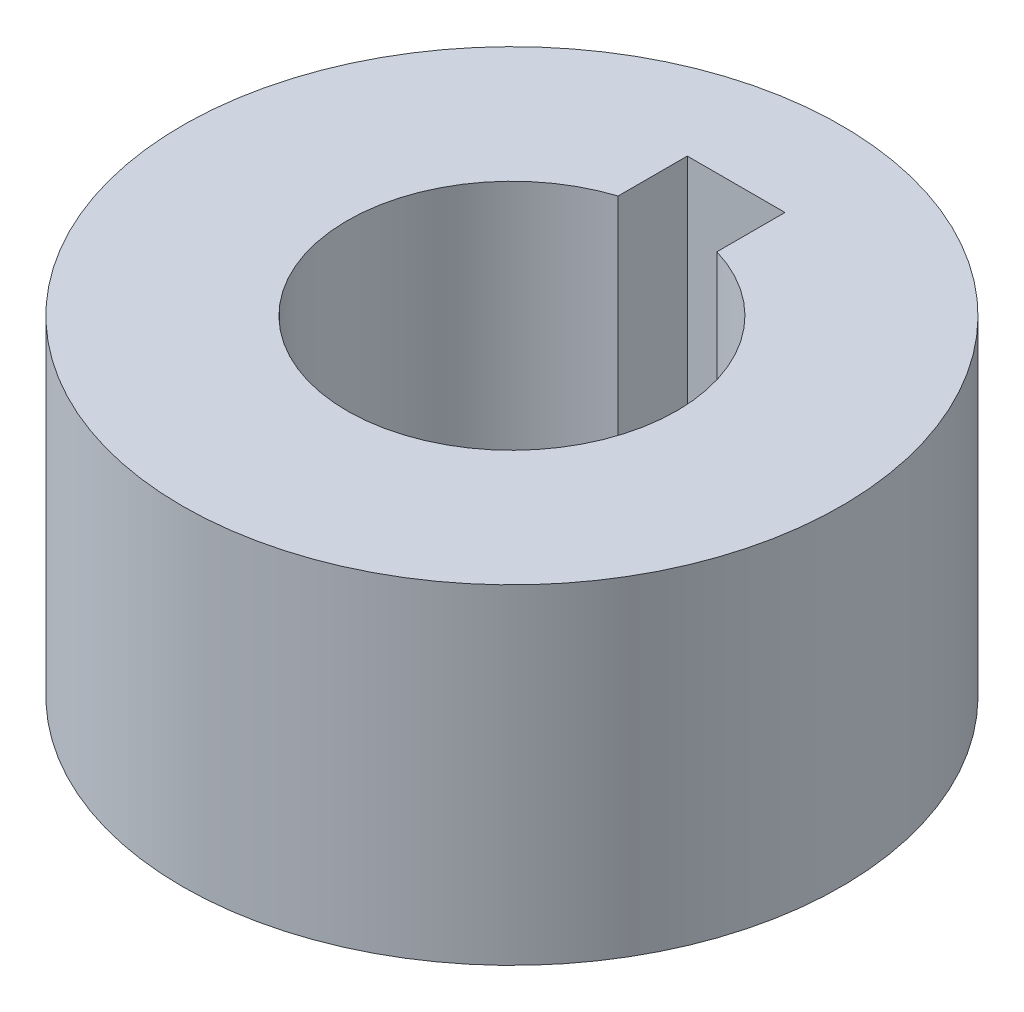
from build123d import *

# Parameters (mm, degrees)
SKETCH_1_R      = 10
EXTRUDE_1_DEPTH = 10


with BuildPart() as part:
    # 스케치1 → 보스-돌출1 (new body)
    with BuildSketch(Plane(origin=(0, 0, 0), x_dir=(1, 0, 0), z_dir=(0, 1, 0))):
        with Locations(Location((0, 0, 0), (0, 0, 270))):
            Circle(SKETCH_1_R)
        with BuildLine():
            ThreePointArc((5, 0), (-2.942731468, -4.042317591), (-1.536132603, 4.758182071))
            Line((-1.536132603, 4.758182071), (-1.536132603, 6.856766437))
            Line((-1.536132603, 6.856766437), (1.428204445, 6.856766437))
            Line((1.428204445, 6.856766437), (1.428204445, 4.791683636))
            ThreePointArc((1.428204445, 4.791683636), (4.0088042, 2.98822504), (5, 0))
        make_face(mode=Mode.SUBTRACT)
    extrude(amount=EXTRUDE_1_DEPTH)


solid = part.part
